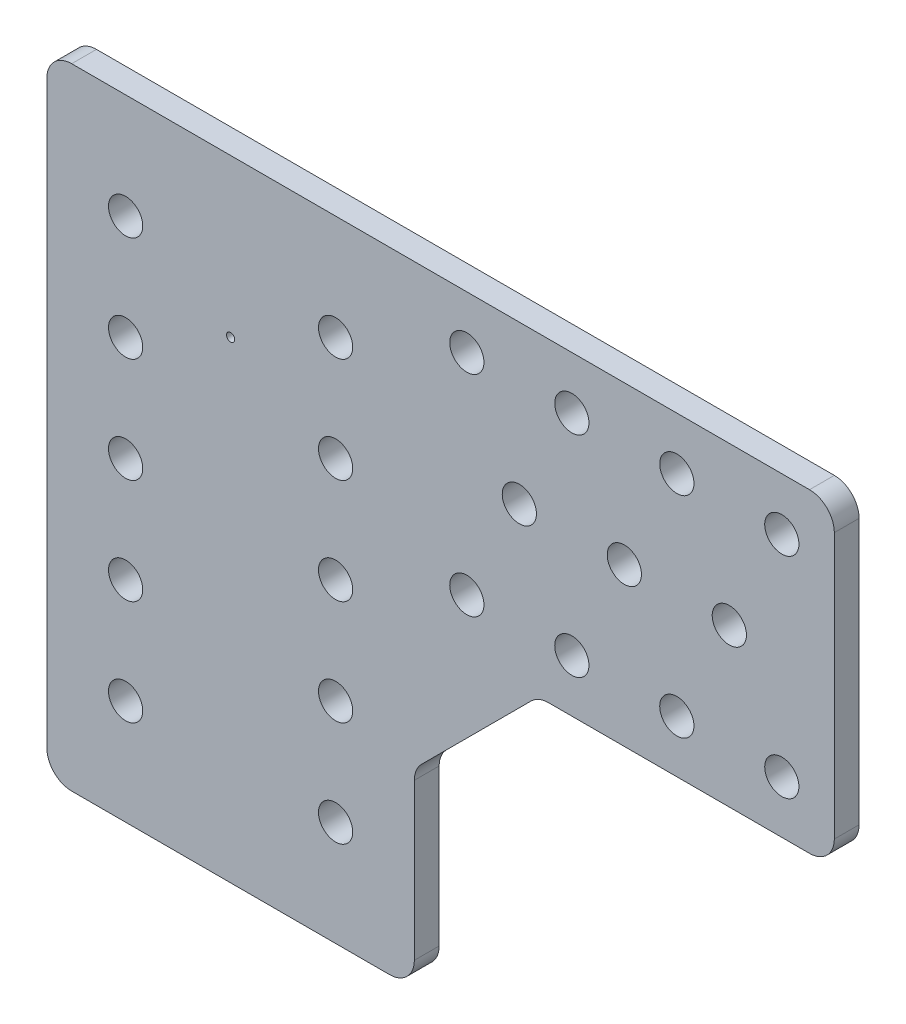
from build123d import *

# Parameters (mm, degrees)
SKETCH1_R           = 0.5
SKETCH1_R_2         = 2.07
BOSS_EXTRUDE1_DEPTH = 1.5
FILLET1_R           = 3
CHAMFER1_SIZE       = 15
FILLET2_R           = 3


with BuildPart() as part:
    # Sketch1 → Boss-Extrude1 (new, symmetric)
    with BuildSketch(Plane.XY):
        Polygon((0, 0), (50.8, 0), (50.8, 38.1), (-44.45, 38.1), (-44.45, -38.1), (0, -38.1), align=None)
        with Locations((-22.225, 19.05)):
            Circle(SKETCH1_R, mode=Mode.SUBTRACT)
        with Locations((44.45, 31.75)):
            Circle(SKETCH1_R_2, mode=Mode.SUBTRACT)
        with Locations((31.75, 31.75)):
            Circle(SKETCH1_R_2, mode=Mode.SUBTRACT)
        with Locations((19.05, 31.75)):
            Circle(SKETCH1_R_2, mode=Mode.SUBTRACT)
        with Locations((6.35, 31.75)):
            Circle(SKETCH1_R_2, mode=Mode.SUBTRACT)
        with Locations(Location((6.35, 6.35, 0), (0, 0, 180))):
            Circle(SKETCH1_R_2, mode=Mode.SUBTRACT)
        with Locations(Location((19.05, 6.35, 0), (0, 0, 180))):
            Circle(SKETCH1_R_2, mode=Mode.SUBTRACT)
        with Locations(Location((31.75, 6.35, 0), (0, 0, 180))):
            Circle(SKETCH1_R_2, mode=Mode.SUBTRACT)
        with Locations(Location((44.45, 6.35, 0), (0, 0, 180))):
            Circle(SKETCH1_R_2, mode=Mode.SUBTRACT)
        with Locations((25.4, 19.05)):
            Circle(SKETCH1_R_2, mode=Mode.SUBTRACT)
        with Locations((38.1, 19.05)):
            Circle(SKETCH1_R_2, mode=Mode.SUBTRACT)
        with Locations(Location((12.7, 19.05, 0), (0, 0, 180))):
            Circle(SKETCH1_R_2, mode=Mode.SUBTRACT)
        with Locations((-34.925, -25.4)):
            Circle(SKETCH1_R_2, mode=Mode.SUBTRACT)
        with Locations((-9.525, -25.4)):
            Circle(SKETCH1_R_2, mode=Mode.SUBTRACT)
        with Locations((-34.925, -12.7)):
            Circle(SKETCH1_R_2, mode=Mode.SUBTRACT)
        with Locations((-9.525, -12.7)):
            Circle(SKETCH1_R_2, mode=Mode.SUBTRACT)
        with Locations((-34.925, 0)):
            Circle(SKETCH1_R_2, mode=Mode.SUBTRACT)
        with Locations((-9.525, 0)):
            Circle(SKETCH1_R_2, mode=Mode.SUBTRACT)
        with Locations((-34.925, 12.7)):
            Circle(SKETCH1_R_2, mode=Mode.SUBTRACT)
        with Locations((-9.525, 12.7)):
            Circle(SKETCH1_R_2, mode=Mode.SUBTRACT)
        with Locations((-34.925, 25.4)):
            Circle(SKETCH1_R_2, mode=Mode.SUBTRACT)
        with Locations((-9.525, 25.4)):
            Circle(SKETCH1_R_2, mode=Mode.SUBTRACT)
    extrude(amount=BOSS_EXTRUDE1_DEPTH, both=True)

    # Fillet1
    fillet1_edges = [part.edges().sort_by_distance(p)[0] for p in [
        (0, -38.1, 0),
        (-44.45, -38.1, 0),
        (-44.45, 38.1, 0),
        (50.8, 38.1, 0),
        (50.8, 0, 0),
    ]]
    fillet(fillet1_edges, radius=FILLET1_R)

    # Chamfer1
    chamfer1_edges = [part.edges().sort_by_distance(p)[0] for p in [
        (0, 0, 0),
    ]]
    chamfer(chamfer1_edges, length=CHAMFER1_SIZE)

    # Fillet2
    fillet2_edges = [part.edges().sort_by_distance(p)[0] for p in [
        (15, 0, 0),
        (0, -15, 0),
    ]]
    fillet(fillet2_edges, radius=FILLET2_R)


solid = part.part
